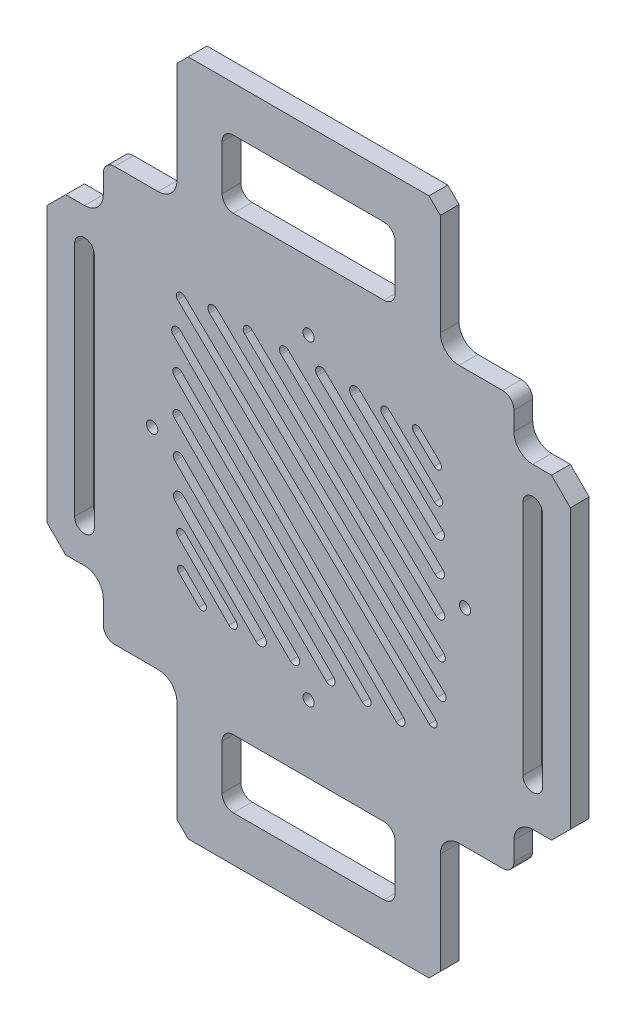
from build123d import *

# Parameters (mm, degrees)
SKETCH1_R           = 1.5
BOSS_EXTRUDE1_DEPTH = 5


with BuildPart() as part:
    # Sketch1 → Boss-Extrude1 (new body)
    with BuildSketch(Plane.XY):
        with BuildLine():
            Line((-15, 92), (-10, 97))
            Line((-10, 97), (-5, 97))
            ThreePointArc((-5, 97), (-1.464466094, 98.464466094), (0, 102))
            Line((0, 102), (0, 107))
            ThreePointArc((0, 107), (0.878679656, 109.121320344), (3, 110))
            Line((3, 110), (14.566367929, 110))
            ThreePointArc((14.566367929, 110), (18.101901835, 111.464466094), (19.566367929, 115))
            Line((19.566367929, 115), (19.566367929, 142))
            Line((19.566367929, 142), (22.566367929, 145))
            Line((22.566367929, 145), (86.566367929, 145))
            Line((86.566367929, 145), (89.566367929, 142))
            Line((89.566367929, 142), (89.566367929, 115))
            ThreePointArc((89.566367929, 115), (91.030834023, 111.464466094), (94.566367929, 110))
            Line((94.566367929, 110), (106.132735857, 110))
            ThreePointArc((106.132735857, 110), (108.254056201, 109.121320344), (109.132735857, 107))
            Line((109.132735857, 107), (109.132735857, 102))
            ThreePointArc((109.132735857, 102), (110.597201951, 98.464466094), (114.132735857, 97))
            Line((114.132735857, 97), (119.132735857, 97))
            Line((119.132735857, 97), (124.132735857, 92))
            Line((124.132735857, 92), (124.132735857, 18))
            Line((124.132735857, 18), (119.132735857, 13))
            Line((119.132735857, 13), (114.132735857, 13))
            ThreePointArc((114.132735857, 13), (110.597201951, 11.535533906), (109.132735857, 8))
            Line((109.132735857, 8), (109.132735857, 3))
            ThreePointArc((109.132735857, 3), (108.254056201, 0.878679656), (106.132735857, 0))
            Line((106.132735857, 0), (94.566367929, 0))
            ThreePointArc((94.566367929, 0), (91.030834023, -1.464466094), (89.566367929, -5))
            Line((89.566367929, -5), (89.566367929, -32))
            Line((89.566367929, -32), (86.566367929, -35))
            Line((86.566367929, -35), (22.566367929, -35))
            Line((22.566367929, -35), (19.566367929, -32))
            Line((19.566367929, -32), (19.566367929, -5))
            ThreePointArc((19.566367929, -5), (18.101901835, -1.464466094), (14.566367929, 0))
            Line((14.566367929, 0), (3, 0))
            ThreePointArc((3, 0), (0.878679656, 0.878679656), (0, 3))
            Line((0, 3), (0, 9.1034271))
            ThreePointArc((0, 9.1034271), (-1.464466094, 12.638961006), (-5, 14.1034271))
            Line((-5, 14.1034271), (-10, 14.1034271))
            Line((-10, 14.1034271), (-15, 19.1034271))
            Line((-15, 19.1034271), (-15, 92))
        make_face()
        with Locations((54.566367929, 97)):
            Circle(SKETCH1_R, mode=Mode.SUBTRACT)
        with Locations((54.566367929, 13)):
            Circle(SKETCH1_R, mode=Mode.SUBTRACT)
        with Locations((96.132735857, 55)):
            Circle(SKETCH1_R, mode=Mode.SUBTRACT)
        with Locations((13, 55)):
            Circle(SKETCH1_R, mode=Mode.SUBTRACT)
        with BuildLine():
            Line((34.566367929, 133), (74.566367929, 133))
            ThreePointArc((74.566367929, 133), (76.687688272, 132.121320344), (77.566367929, 130))
            Line((77.566367929, 130), (77.566367929, 118))
            ThreePointArc((77.566367929, 118), (76.687688272, 115.878679656), (74.566367929, 115))
            Line((74.566367929, 115), (34.566367929, 115))
            ThreePointArc((34.566367929, 115), (32.445047585, 115.878679656), (31.566367929, 118))
            Line((31.566367929, 118), (31.566367929, 130))
            ThreePointArc((31.566367929, 130), (32.445047585, 132.121320344), (34.566367929, 133))
        make_face(mode=Mode.SUBTRACT)
        with BuildLine():
            Line((34.566367929, -23), (74.566367929, -23))
            ThreePointArc((74.566367929, -23), (76.687688272, -22.121320344), (77.566367929, -20))
            Line((77.566367929, -20), (77.566367929, -8))
            ThreePointArc((77.566367929, -8), (76.687688272, -5.878679656), (74.566367929, -5))
            Line((74.566367929, -5), (34.566367929, -5))
            ThreePointArc((34.566367929, -5), (32.445047585, -5.878679656), (31.566367929, -8))
            Line((31.566367929, -8), (31.566367929, -20))
            ThreePointArc((31.566367929, -20), (32.445047585, -22.121320344), (34.566367929, -23))
        make_face(mode=Mode.SUBTRACT)
        with BuildLine():
            Line((-7.610040083, 24.1034271), (-7.610040083, 87))
            ThreePointArc((-7.610040083, 87), (-5, 89.610040083), (-2.389959917, 87))
            Line((-2.389959917, 87), (-2.389959917, 24.1034271))
            ThreePointArc((-2.389959917, 24.1034271), (-5, 21.493387017), (-7.610040083, 24.1034271))
        make_face(mode=Mode.SUBTRACT)
        with BuildLine():
            Line((116.74277594, 24.1034271), (116.74277594, 87))
            ThreePointArc((116.74277594, 87), (114.132735857, 89.610040083), (111.522695774, 87))
            Line((111.522695774, 87), (111.522695774, 24.1034271))
            ThreePointArc((111.522695774, 24.1034271), (114.132735857, 21.493387017), (116.74277594, 24.1034271))
        make_face(mode=Mode.SUBTRACT)
        with BuildLine():
            Line((21.529947274, 89.468147489), (88.351003471, 25.308726653))
            ThreePointArc((88.351003471, 25.308726653), (88.386999729, 23.537331865), (86.615604941, 23.501335607))
            Line((86.615604941, 23.501335607), (19.794548743, 87.660756443))
            ThreePointArc((19.794548743, 87.660756443), (19.758552485, 89.432151231), (21.529947274, 89.468147489))
        make_face(mode=Mode.SUBTRACT)
        with BuildLine():
            Line((30.141972391, 90.830211564), (90.687510201, 32.696340879))
            ThreePointArc((90.687510201, 32.696340879), (90.727054178, 30.750360947), (88.781074246, 30.71081697))
            Line((88.781074246, 30.71081697), (28.235536436, 88.844687655))
            ThreePointArc((28.235536436, 88.844687655), (28.195992459, 90.790667587), (30.141972391, 90.830211564))
        make_face(mode=Mode.SUBTRACT)
        with BuildLine():
            Line((39.483266545, 90.686865308), (90.503044374, 41.699321816))
            ThreePointArc((90.503044374, 41.699321816), (90.542042113, 39.780222555), (88.622942851, 39.741224816))
            Line((88.622942851, 39.741224816), (37.603165023, 88.728768307))
            ThreePointArc((37.603165023, 88.728768307), (37.564167284, 90.647867569), (39.483266545, 90.686865308))
        make_face(mode=Mode.SUBTRACT)
        with BuildLine():
            Line((49.153982666, 90.837738164), (90.341625616, 51.290693151))
            ThreePointArc((90.341625616, 51.290693151), (90.381469395, 49.329959822), (88.420736066, 49.290116043))
            Line((88.420736066, 49.290116043), (47.233093116, 88.837161056))
            ThreePointArc((47.233093116, 88.837161056), (47.193249337, 90.797894385), (49.153982666, 90.837738164))
        make_face(mode=Mode.SUBTRACT)
        with BuildLine():
            Line((58.913272098, 90.890808974), (90.212200397, 60.838588511))
            ThreePointArc((90.212200397, 60.838588511), (90.254158107, 58.773827493), (88.189397089, 58.731869782))
            Line((88.189397089, 58.731869782), (56.89046879, 88.784090246))
            ThreePointArc((56.89046879, 88.784090246), (56.84851108, 90.848851264), (58.913272098, 90.890808974))
        make_face(mode=Mode.SUBTRACT)
        with BuildLine():
            Line((68.200844973, 90.997320319), (90.14380499, 69.928398542))
            ThreePointArc((90.14380499, 69.928398542), (90.190005291, 67.654857424), (87.916464173, 67.608657123))
            Line((87.916464173, 67.608657123), (65.973504156, 88.677578901))
            ThreePointArc((65.973504156, 88.677578901), (65.927303856, 90.951120018), (68.200844973, 90.997320319))
        make_face(mode=Mode.SUBTRACT)
        with BuildLine():
            Line((75.985646215, 90.418887754), (89.801777498, 77.153084552))
            ThreePointArc((89.801777498, 77.153084552), (89.839647655, 75.289474178), (87.976037281, 75.251604021))
            Line((87.976037281, 75.251604021), (74.159905999, 88.517407223))
            ThreePointArc((74.159905999, 88.517407223), (74.122035842, 90.381017597), (75.985646215, 90.418887754))
        make_face(mode=Mode.SUBTRACT)
        with BuildLine():
            Line((84.164714184, 90.316514556), (89.552781085, 85.143066673))
            ThreePointArc((89.552781085, 85.143066673), (89.586573484, 83.480124936), (87.923631748, 83.446332537))
            Line((87.923631748, 83.446332537), (82.535564847, 88.619780421))
            ThreePointArc((82.535564847, 88.619780421), (82.501772448, 90.282722157), (84.164714184, 90.316514556))
        make_face(mode=Mode.SUBTRACT)
        with BuildLine():
            Line((20.116699843, 25.040162824), (25.391558074, 19.751335111))
            ThreePointArc((25.391558074, 19.751335111), (27.054841666, 19.749135575), (27.057041202, 21.412419167))
            Line((27.057041202, 21.412419167), (21.782182971, 26.701246879))
            ThreePointArc((21.782182971, 26.701246879), (20.118899379, 26.703446416), (20.116699843, 25.040162824))
        make_face(mode=Mode.SUBTRACT)
        with BuildLine():
            Line((19.858987713, 33.215810662), (33.384828271, 19.654149429))
            ThreePointArc((33.384828271, 19.654149429), (35.248821752, 19.651684473), (35.251286708, 21.515677954))
            Line((35.251286708, 21.515677954), (21.72544615, 35.077339187))
            ThreePointArc((21.72544615, 35.077339187), (19.861452669, 35.079804143), (19.858987713, 33.215810662))
        make_face(mode=Mode.SUBTRACT)
        with BuildLine():
            Line((19.132791007, 40.988220389), (40.614707507, 19.449413025))
            ThreePointArc((40.614707507, 19.449413025), (42.888716002, 19.446405862), (42.891723164, 21.720414358))
            Line((42.891723164, 21.720414358), (21.409806664, 43.259221722))
            ThreePointArc((21.409806664, 43.259221722), (19.135798169, 43.262228884), (19.132791007, 40.988220389))
        make_face(mode=Mode.SUBTRACT)
        with BuildLine():
            Line((19.062870224, 50.276140805), (49.704176763, 19.55368646))
            ThreePointArc((49.704176763, 19.55368646), (51.76936224, 19.550955446), (51.772093254, 21.616140923))
            Line((51.772093254, 21.616140923), (21.130786715, 52.338595268))
            ThreePointArc((21.130786715, 52.338595268), (19.065601238, 52.341326282), (19.062870224, 50.276140805))
        make_face(mode=Mode.SUBTRACT)
        with BuildLine():
            Line((18.930558524, 60.034677598), (59.252807938, 19.6056422))
            ThreePointArc((59.252807938, 19.6056422), (61.21394434, 19.603048781), (61.216537759, 21.564185183))
            Line((61.216537759, 21.564185183), (20.894288344, 61.993220582))
            ThreePointArc((20.894288344, 61.993220582), (18.933151942, 61.995814), (18.930558524, 60.034677598))
        make_face(mode=Mode.SUBTRACT)
        with BuildLine():
            Line((18.897713631, 69.706514762), (68.845514944, 19.626435978))
            ThreePointArc((68.845514944, 19.626435978), (70.76500872, 19.623897628), (70.76754707, 21.543391404))
            Line((70.76754707, 21.543391404), (20.819745757, 71.623470187))
            ThreePointArc((20.819745757, 71.623470187), (18.900251981, 71.626008538), (18.897713631, 69.706514762))
        make_face(mode=Mode.SUBTRACT)
        with BuildLine():
            Line((18.576959915, 79.043400842), (77.850375474, 19.613010658))
            ThreePointArc((77.850375474, 19.613010658), (79.796755446, 19.610436753), (79.79932935, 21.556816725))
            Line((79.79932935, 21.556816725), (20.525913792, 80.98720691))
            ThreePointArc((20.525913792, 80.98720691), (18.57953382, 80.989780815), (18.576959915, 79.043400842))
        make_face(mode=Mode.SUBTRACT)
    extrude(amount=BOSS_EXTRUDE1_DEPTH)


solid = part.part
